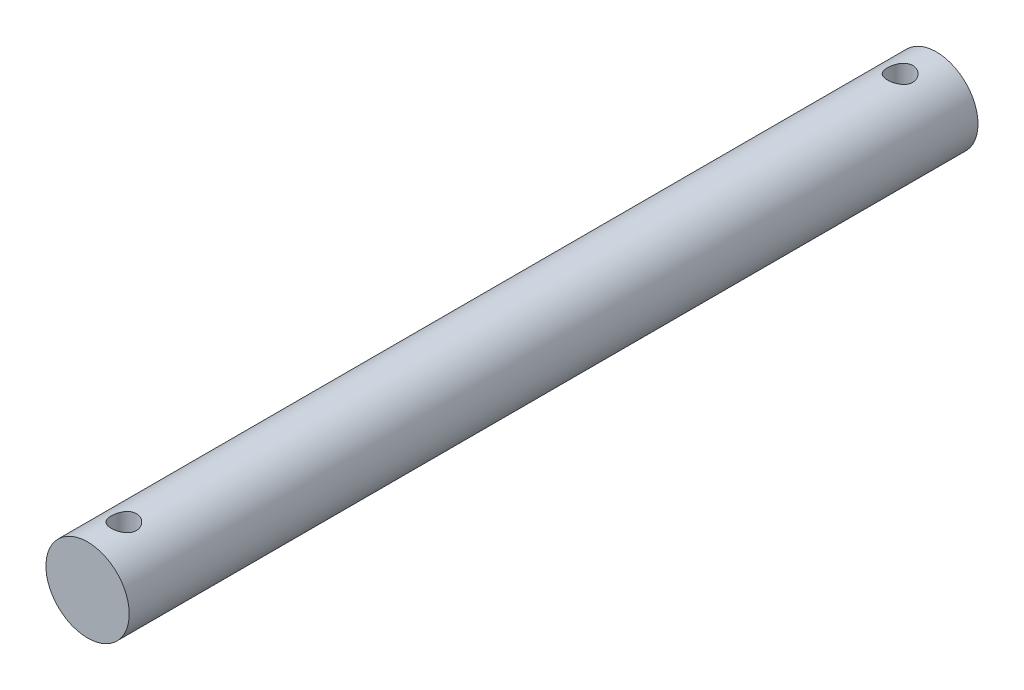
from build123d import *

# Parameters (mm, degrees)
SKETCH3_R           = 5.75
BOSS_EXTRUDE1_DEPTH = 117.15
SKETCH4_R           = 1.75
CUT_EXTRUDE2_DEPTH  = 15
SKETCH5_R           = 1.75
CUT_EXTRUDE3_DEPTH  = 13


with BuildPart() as part:
    # Sketch3 → Boss-Extrude1 (new body)
    with BuildSketch(Plane.XY):
        Circle(SKETCH3_R)
    extrude(amount=BOSS_EXTRUDE1_DEPTH)

    # Sketch4 → Cut-Extrude2 (cut, symmetric)
    with BuildSketch(Plane(origin=(0, 0, 0), x_dir=(1, 0, 0), z_dir=(0, 1, 0))):
        with Locations(Location((0, -5, 0), (0, 0, 90))):
            Circle(SKETCH4_R)
    extrude(amount=CUT_EXTRUDE2_DEPTH, both=True, mode=Mode.SUBTRACT)

    # Sketch5 → Cut-Extrude3 (cut, symmetric)
    with BuildSketch(Plane(origin=(0, 0, 0), x_dir=(0, 0, -1), z_dir=(0, 1, 0))):
        with Locations(Location((-112.15, 0, 0), (0, 0, 180))):
            Circle(SKETCH5_R)
    extrude(amount=CUT_EXTRUDE3_DEPTH, both=True, mode=Mode.SUBTRACT)


solid = part.part
